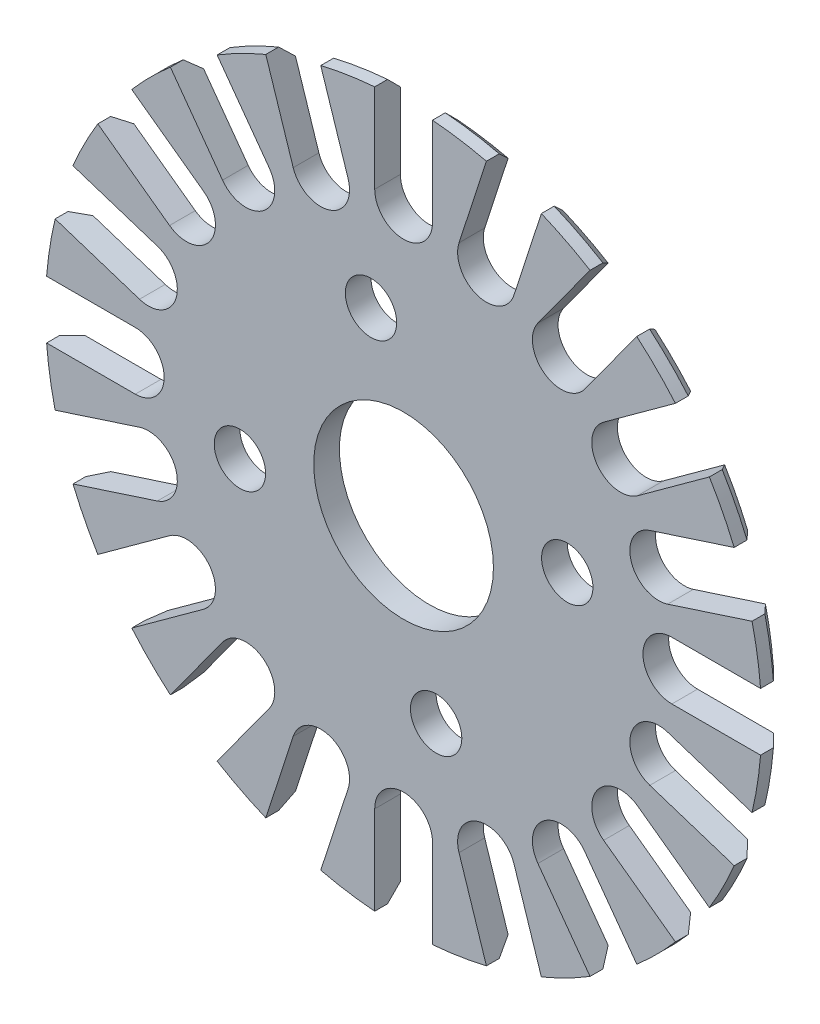
from build123d import *

# Parameters (mm, degrees)
SKETCH_1_R               = 27.9
EXTRUDE_1_DEPTH          = 2
SKETCH_2_R               = 7
CUT_EXTRUDE_2_DEPTH      = 3
SKETCH_3_R               = 2
CUT_EXTRUDE_3_DEPTH      = 3
PATTERN_CIRCULAR_1_COUNT = 4
CHAMFER_1_SIZE           = 1
CUT_EXTRUDE_START        = -3
CUT_EXTRUDE_4_DEPTH      = 3
PATTERN_CIRCULAR_3_COUNT = 20


with BuildPart() as part:
    # 草图1 → 拉伸1 (new body)
    with BuildSketch(Plane.XY):
        Circle(SKETCH_1_R)
    extrude(amount=EXTRUDE_1_DEPTH)

    # 草图2 → 拉伸2 (cut)
    with BuildSketch(Plane.XY.offset(2)):
        Circle(SKETCH_2_R)
    extrude(amount=-CUT_EXTRUDE_2_DEPTH, mode=Mode.SUBTRACT)

    # 草图3 → 拉伸3 (cut)
    with BuildSketch(Plane.XY.offset(2)):
        with Locations((-2.536174186, 12.750208645)):
            Circle(SKETCH_3_R)
    cut_extrude_3 = extrude(amount=-CUT_EXTRUDE_3_DEPTH, mode=Mode.SUBTRACT)

    # 阵列(圆周)1: 拉伸3 ×4 about axis
    pattern_circular_1_axis = Axis((0, 0, 0), (0, 0, 1))
    for i in range(1, PATTERN_CIRCULAR_1_COUNT):
        add(cut_extrude_3.rotate(pattern_circular_1_axis, i * 360 / PATTERN_CIRCULAR_1_COUNT), mode=Mode.SUBTRACT)

    # 倒角1
    chamfer_1_edges = [part.edges().sort_by_distance(p)[0] for p in [
        (-27.9, 0, 0),
    ]]
    chamfer(chamfer_1_edges, length=CHAMFER_1_SIZE)

    # 草图4 → 拉伸4 (cut)
    with BuildSketch(Plane.XY.offset(2).offset(CUT_EXTRUDE_START)):
        with BuildLine():
            Line((-20.9, 2.25), (-27.8091262, 2.25))
            ThreePointArc((-27.8091262, 2.25), (-27.9, 0), (-27.8091262, -2.25))
            Line((-27.8091262, -2.25), (-20.9, -2.25))
            ThreePointArc((-20.9, -2.25), (-18.65, 0), (-20.9, 2.25))
        make_face()
    cut_extrude_4 = extrude(amount=CUT_EXTRUDE_4_DEPTH, mode=Mode.SUBTRACT)

    # 阵列(圆周)3: 拉伸4 ×20 about axis
    pattern_circular_3_axis = Axis((0, 0, 0), (0, 0, 1))
    for i in range(1, PATTERN_CIRCULAR_3_COUNT):
        add(cut_extrude_4.rotate(pattern_circular_3_axis, i * 360 / PATTERN_CIRCULAR_3_COUNT), mode=Mode.SUBTRACT)


solid = part.part
